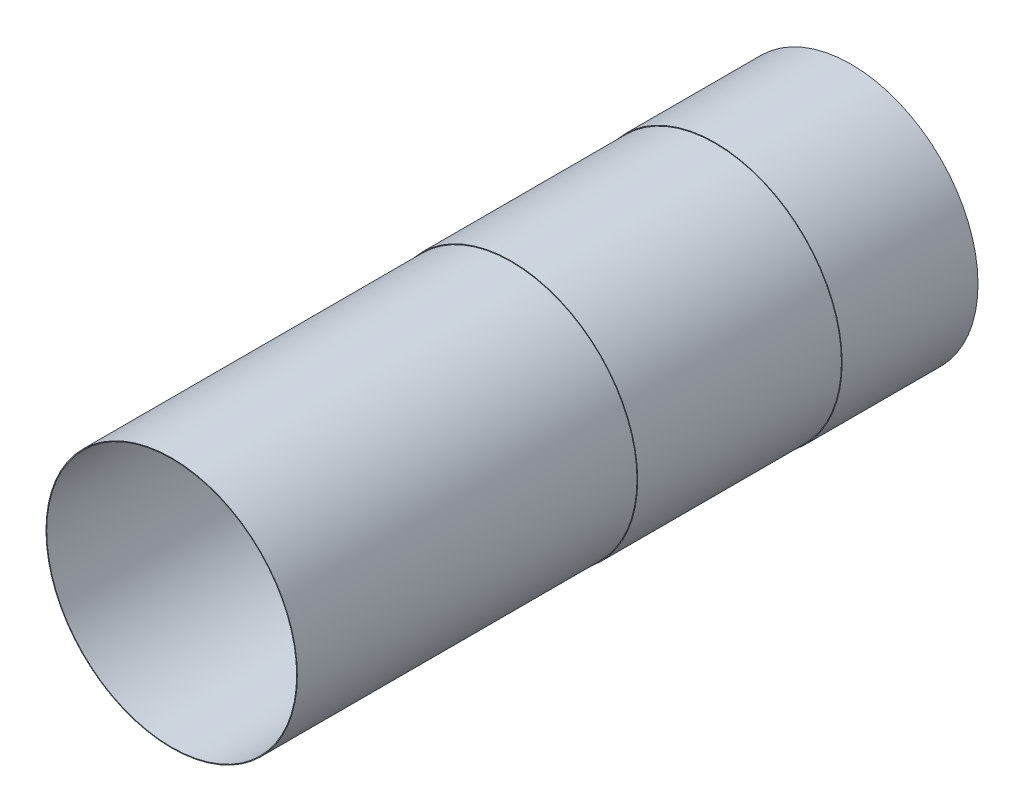
from build123d import *

# Parameters (mm, degrees)
SKETCH2_R           = 187
SKETCH2_R_2         = 184
EXTRUDE_THIN1_DEPTH = 200
SKETCH3_R           = 186
SKETCH3_R_2         = 184
EXTRUDE_THIN2_DEPTH = 300
SKETCH4_R           = 185
SKETCH4_R_2         = 184
EXTRUDE_THIN3_DEPTH = 500


with BuildPart() as part:
    # Sketch2 → Extrude-Thin1 (new body)
    with BuildSketch(Plane.XY):
        Circle(SKETCH2_R)
        Circle(SKETCH2_R_2, mode=Mode.SUBTRACT)
    extrude(amount=EXTRUDE_THIN1_DEPTH)


with BuildPart() as body_2:
    # Sketch3 → Extrude-Thin2 (new body)
    with BuildSketch(Plane.XY.offset(200)):
        Circle(SKETCH3_R)
        Circle(SKETCH3_R_2, mode=Mode.SUBTRACT)
    extrude(amount=EXTRUDE_THIN2_DEPTH)


with BuildPart() as body_3:
    # Sketch4 → Extrude-Thin3 (new body)
    with BuildSketch(Plane.XY.offset(500)):
        Circle(SKETCH4_R)
        Circle(SKETCH4_R_2, mode=Mode.SUBTRACT)
    extrude(amount=EXTRUDE_THIN3_DEPTH)


solid = Compound([part.part, body_2.part, body_3.part])
